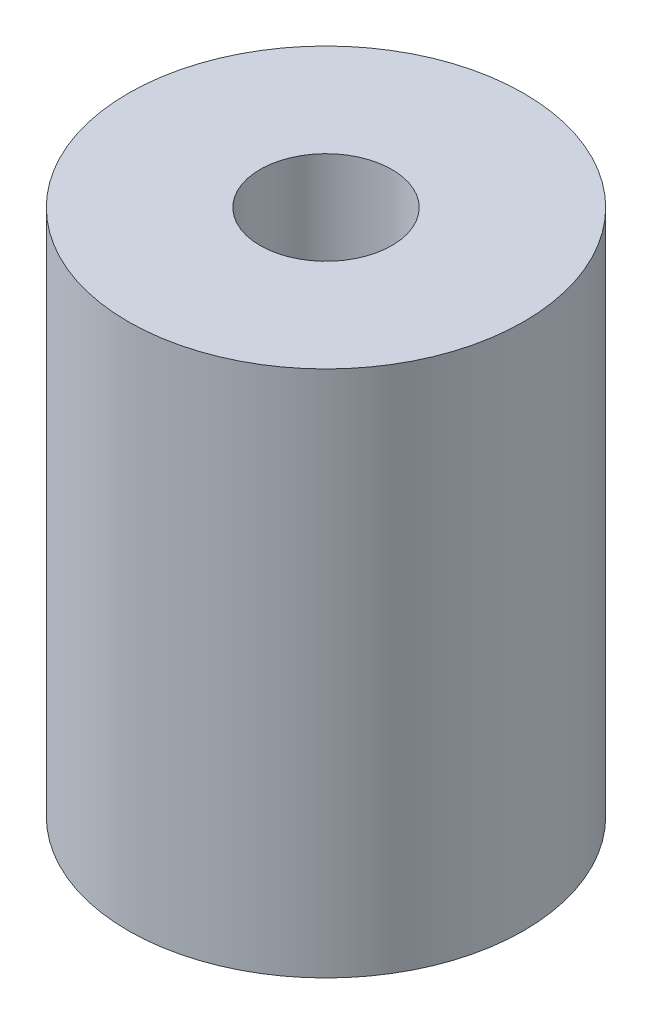
from build123d import *

# Parameters (mm, degrees)
SKETCH1_R           = 9.525
SKETCH1_R_2         = 1.5875
BOSS_EXTRUDE1_DEPTH = 12.7
SKETCH2_R           = 3.175
CUT_EXTRUDE1_DEPTH  = 8.466666667


with BuildPart() as part:
    # Sketch1 → Boss-Extrude1 (new, symmetric)
    with BuildSketch(Plane(origin=(0, 0, 0), x_dir=(1, 0, 0), z_dir=(0, 1, 0))):
        with Locations(Location((0, 0, 0), (0, 0, 270))):
            Circle(SKETCH1_R)
        with Locations(Location((0, 0, 0), (0, 0, 270))):
            Circle(SKETCH1_R_2, mode=Mode.SUBTRACT)
    extrude(amount=BOSS_EXTRUDE1_DEPTH, both=True)

    # Sketch2 → Cut-Extrude1 (cut)
    with BuildSketch(Plane(origin=(0, 12.7, 0), x_dir=(1, 0, 0), z_dir=(0, 1, 0))):
        with Locations(Location((0, 0, 0), (0, 0, 270))):
            Circle(SKETCH2_R)
    cut_extrude1 = extrude(amount=-CUT_EXTRUDE1_DEPTH, mode=Mode.SUBTRACT)

    # Mirror1: Cut-Extrude1 across plane
    add(cut_extrude1.mirror(Plane.ZX), mode=Mode.SUBTRACT)


solid = part.part
